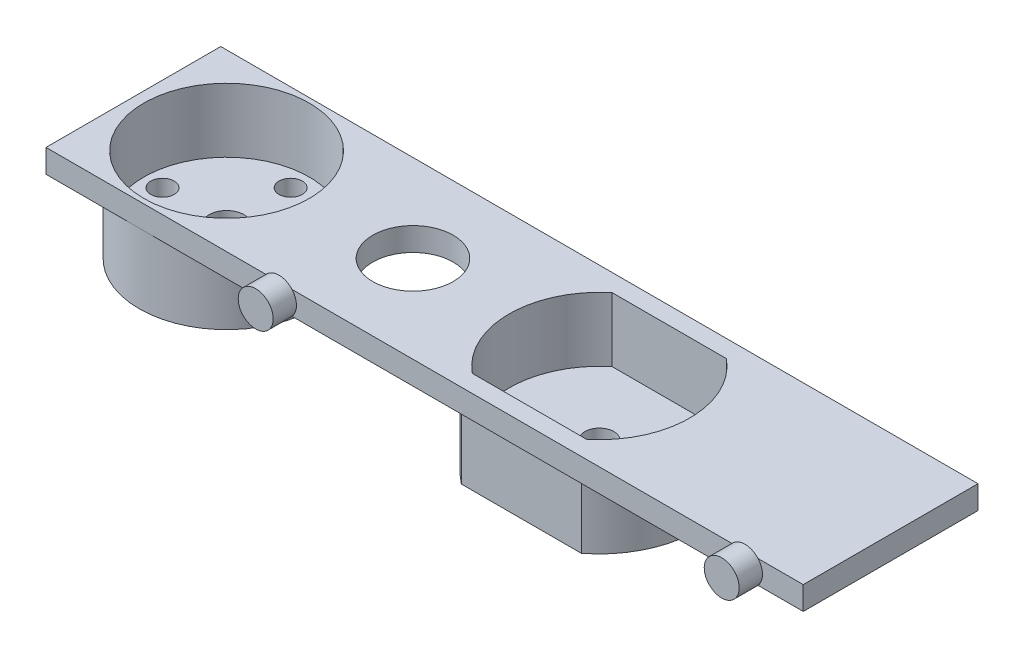
from build123d import *

# Parameters (mm, degrees)
SKETCH_1_W          = 65
SKETCH_1_H          = 15
EXTRUDE_1_DEPTH     = 2
SKETCH_2_R          = 1.25
SKETCH_2_R_2        = 3.45
SKETCH_2_R_3        = 1.5
SKETCH_2_R_4        = 1
CUT_EXTRUDE_1_DEPTH = 2
SKETCH_4_R          = 1.5
EXTRUDE_2_DEPTH     = 2
SKETCH_5_R          = 7.5
SKETCH_5_R_2        = 7.1
EXTRUDE_3_DEPTH     = 8
EXTRUDE_START       = -8
SKETCH_5_5_R        = 1.25
SKETCH_5_5_R_2      = 7.1
SKETCH_5_5_R_3      = 1
SKETCH_5_5_R_4      = 1.5
EXTRUDE_4_DEPTH     = 6
CUT_EXTRUDE_START   = -5.5
SKETCH_5_6_R        = 1.25
SKETCH_5_6_R_2      = 7.1
CUT_EXTRUDE_3_DEPTH = 5.5


with BuildPart() as part:
    # 草图1 → 凸台-拉伸1 (new body)
    with BuildSketch(Plane(origin=(0, 0, 0), x_dir=(1, 0, 0), z_dir=(0, 1, 0))):
        with Locations((-7.5, 0)):
            Rectangle(SKETCH_1_W, SKETCH_1_H)
    extrude(amount=EXTRUDE_1_DEPTH)

    # 草图2 → 切除-拉伸1 (cut)
    with BuildSketch(Plane(origin=(0, 0, 0), x_dir=(1, 0, 0), z_dir=(0, 1, 0))):
        with Locations(Location((0, 0, 0), (0, 0, 270))):
            Circle(SKETCH_2_R)
        with Locations(Location((-16, 0, 0), (0, 0, 90))):
            Circle(SKETCH_2_R_2)
        with Locations(Location((-32, 0, 0), (0, 0, 270))):
            Circle(SKETCH_2_R_3)
        with Locations(Location((-26.5, 0, 0), (0, 0, 270))):
            Circle(SKETCH_2_R_4)
        with Locations(Location((-32, -5.5, 0), (0, 0, 270))):
            Circle(SKETCH_2_R_4)
        with Locations(Location((-37.5, 0, 0), (0, 0, 270))):
            Circle(SKETCH_2_R_4)
        with Locations(Location((-32, 5.5, 0), (0, 0, 270))):
            Circle(SKETCH_2_R_4)
    extrude(amount=CUT_EXTRUDE_1_DEPTH, mode=Mode.SUBTRACT)

    # 草图4 → 凸台-拉伸2 (add)
    with BuildSketch(Plane.XY.offset(7.5)):
        with Locations(Location((20, 1, 0), (0, 0, 221.810314896))):
            Circle(SKETCH_4_R)
        with Locations(Location((-20, 1, 0), (0, 0, 221.810314896))):
            Circle(SKETCH_4_R)
    extrude(amount=EXTRUDE_2_DEPTH)

    # 草图5 → 凸台-拉伸3 (add)
    # profile 1 of 2: a face of its own
    with BuildSketch(Plane(origin=(0, 2, 0), x_dir=(1, 0, 0), z_dir=(0, 1, 0))):
        with Locations(Location((-32, 0, 0), (0, 0, 270))):
            Circle(SKETCH_5_R)
        with Locations(Location((-32, 0, 0), (0, 0, 270))):
            Circle(SKETCH_5_R_2, mode=Mode.SUBTRACT)
    # profile 2 of 2: a face of its own
    with BuildSketch(Plane(origin=(0, 2, 0), x_dir=(1, 0, 0), z_dir=(0, 1, 0))):
        with BuildLine():
            Line((5.149029035, -6.7), (-5.149029035, -6.7))
            ThreePointArc((-5.149029035, -6.7), (-8.45, 0), (-5.149029035, 6.7))
            Line((-5.149029035, 6.7), (5.149029035, 6.7))
            ThreePointArc((5.149029035, 6.7), (8.45, 0), (5.149029035, -6.7))
        make_face()
        with BuildLine():
            Line((4.905354218, -6), (-4.905354218, -6))
            ThreePointArc((-4.905354218, -6), (-7.75, 0), (-4.905354218, 6))
            Line((-4.905354218, 6), (4.905354218, 6))
            ThreePointArc((4.905354218, 6), (7.75, 0), (4.905354218, -6))
        make_face(mode=Mode.SUBTRACT)
    extrude(amount=-EXTRUDE_3_DEPTH)

    # 草图5<5> → 凸台-拉伸4 (add)
    # profile 1 of 2: a face of its own
    with BuildSketch(Plane(origin=(0, 2, 0), x_dir=(1, 0, 0), z_dir=(0, 1, 0)).offset(EXTRUDE_START)):
        with BuildLine():
            Line((4.905354218, -6), (-4.905354218, -6))
            ThreePointArc((-4.905354218, -6), (-7.75, 0), (-4.905354218, 6))
            Line((-4.905354218, 6), (4.905354218, 6))
            ThreePointArc((4.905354218, 6), (7.75, 0), (4.905354218, -6))
        make_face()
        with Locations(Location((0, 0, 0), (0, 0, 270))):
            Circle(SKETCH_5_5_R, mode=Mode.SUBTRACT)
    # profile 2 of 2: a face of its own
    with BuildSketch(Plane(origin=(0, 2, 0), x_dir=(1, 0, 0), z_dir=(0, 1, 0)).offset(EXTRUDE_START)):
        with Locations((-32, 0)):
            Circle(SKETCH_5_5_R_2)
        with Locations(Location((-32, 5.5, 0), (0, 0, 270))):
            Circle(SKETCH_5_5_R_3, mode=Mode.SUBTRACT)
        with Locations(Location((-37.5, 0, 0), (0, 0, 270))):
            Circle(SKETCH_5_5_R_3, mode=Mode.SUBTRACT)
        with Locations(Location((-32, 0, 0), (0, 0, 270))):
            Circle(SKETCH_5_5_R_4, mode=Mode.SUBTRACT)
        with Locations(Location((-26.5, 0, 0), (0, 0, 270))):
            Circle(SKETCH_5_5_R_3, mode=Mode.SUBTRACT)
        with Locations(Location((-32, -5.5, 0), (0, 0, 270))):
            Circle(SKETCH_5_5_R_3, mode=Mode.SUBTRACT)
    extrude(amount=EXTRUDE_4_DEPTH)

    # 草图5<6> → 切除-拉伸3 (cut)
    # profile 1 of 2: a face of its own
    with BuildSketch(Plane(origin=(0, 2, 0), x_dir=(1, 0, 0), z_dir=(0, 1, 0)).offset(CUT_EXTRUDE_START)):
        with BuildLine():
            Line((4.905354218, -6), (-4.905354218, -6))
            ThreePointArc((-4.905354218, -6), (-7.75, 0), (-4.905354218, 6))
            Line((-4.905354218, 6), (4.905354218, 6))
            ThreePointArc((4.905354218, 6), (7.75, 0), (4.905354218, -6))
        make_face()
        with Locations(Location((0, 0, 0), (0, 0, 270))):
            Circle(SKETCH_5_6_R, mode=Mode.SUBTRACT)
    # profile 2 of 2: a face of its own
    with BuildSketch(Plane(origin=(0, 2, 0), x_dir=(1, 0, 0), z_dir=(0, 1, 0)).offset(CUT_EXTRUDE_START)):
        with Locations(Location((-32, 0, 0), (0, 0, 270))):
            Circle(SKETCH_5_6_R_2)
    extrude(amount=CUT_EXTRUDE_3_DEPTH, mode=Mode.SUBTRACT)


solid = part.part
